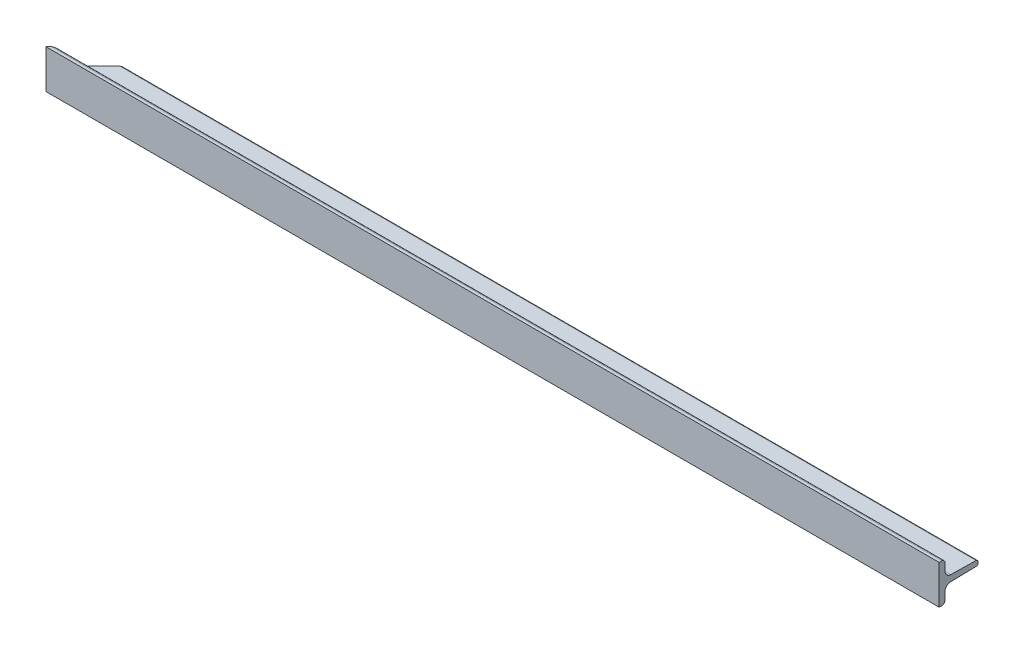
from build123d import *

# Parameters (mm, degrees)
T_SECTION_T_20_X_20_1_DEPTH = 460
SKETCH13_W                  = 20
SKETCH13_H                  = 30
CUT_EXTRUDE1_DEPTH          = 451.22216738


with BuildPart() as part:
    # Sketch12 → T section T 20 X 20(1) (new body)
    with BuildSketch(Plane.YZ):
        with BuildLine():
            Line((-10, 20), (10, 20))
            Line((10, 20), (10, 18.570314587))
            ThreePointArc((10, 18.570314587), (9.571214338, 17.520314662), (8.530000209, 17.070614622))
            Line((8.530000209, 17.070614622), (4.520436432, 16.990406743))
            ThreePointArc((4.520436432, 16.990406743), (2.459116507, 16.112327155), (1.581036919, 14.05100723))
            Line((1.581036919, 14.05100723), (1.319562646, 0.97999986))
            ThreePointArc((1.319562646, 0.97999986), (1.019762619, 0.285857108), (0.319762669, 0))
            Line((0.319762669, 0), (-0.319762669, 0))
            ThreePointArc((-0.319762669, 0), (-1.019762619, 0.285857108), (-1.319562646, 0.97999986))
            Line((-1.319562646, 0.97999986), (-1.581036919, 14.05100723))
            ThreePointArc((-1.581036919, 14.05100723), (-2.459116507, 16.112327155), (-4.520436432, 16.990406743))
            Line((-4.520436432, 16.990406743), (-8.530000209, 17.070614622))
            ThreePointArc((-8.530000209, 17.070614622), (-9.571214338, 17.520314662), (-10, 18.570314587))
            Line((-10, 18.570314587), (-10, 20))
        make_face()
    extrude(amount=T_SECTION_T_20_X_20_1_DEPTH)

    # Sketch13 → Cut-Extrude1 (cut, through all)
    with BuildSketch(Plane(origin=(10, 0, 10), x_dir=(0, -1, 0), z_dir=(-0.7071067811865464, 0, -0.7071067811865488))):
        Rectangle(SKETCH13_W, SKETCH13_H)
    extrude(amount=CUT_EXTRUDE1_DEPTH, mode=Mode.SUBTRACT)


solid = part.part
